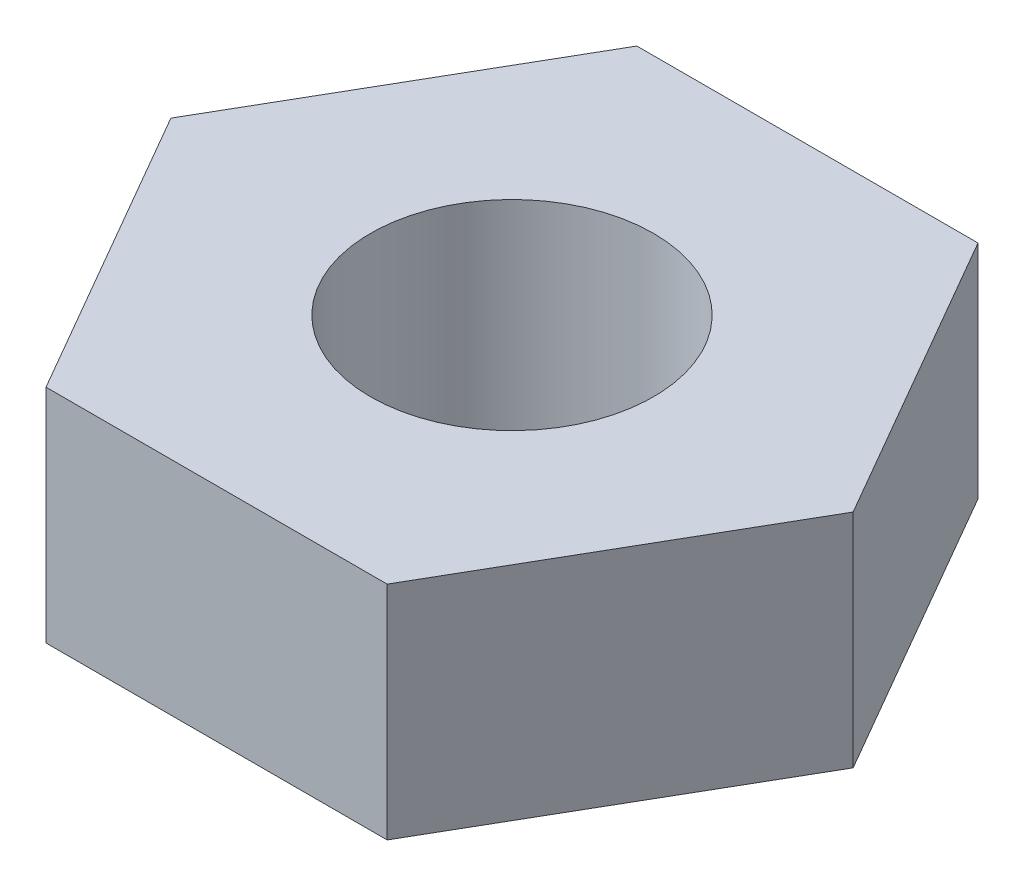
from build123d import *

# Parameters (mm, degrees)
SKETCH_1_R      = 1.15
EXTRUDE_1_DEPTH = 1.8


with BuildPart() as part:
    # 草图1 → 凸台-拉伸1 (new body)
    with BuildSketch(Plane(origin=(0, 0, 0), x_dir=(1, 0, 0), z_dir=(0, 1, 0))):
        Polygon((2.771281292, 0), (1.385640646, 2.4), (-1.385640646, 2.4), (-2.771281292, 0), (-1.385640646, -2.4), (1.385640646, -2.4), align=None)
        with Locations(Location((0, 0, 0), (0, 0, 270))):
            Circle(SKETCH_1_R, mode=Mode.SUBTRACT)
    extrude(amount=EXTRUDE_1_DEPTH)


solid = part.part
